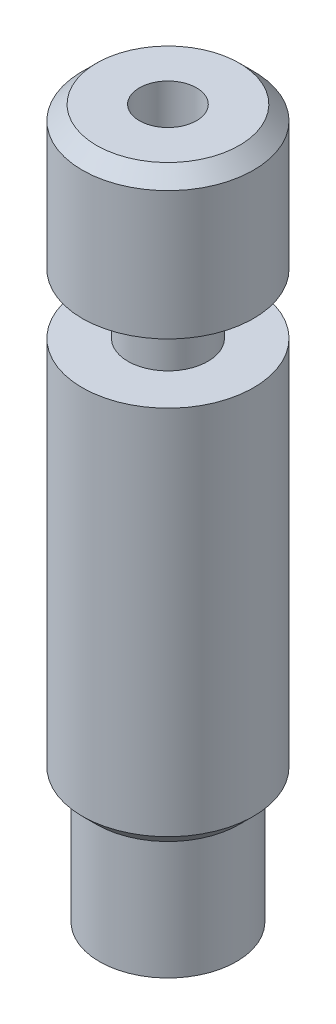
from build123d import *


with BuildPart() as part:
    # Sketch1 → Revolve1 (revolve)
    with BuildSketch(Plane.XY, mode=Mode.PRIVATE) as revolve1_sk:
        Polygon((1, -12.15), (1, 12.55), (2.5, 12.55), (3, 12.05), (3, 7.55), (1.4, 7.55), (1.4, 5.45), (3, 5.45), (3, -7.55), (2.5, -8.05), (2.4, -8.05), (2.4, -12.261324865), (1.9, -12.55), (1.4, -12.55), align=None)
    revolve(revolve1_sk.sketch.rotate(Axis((0, 12.55, 0), (0, -1, 0)), 90), axis=Axis((0, 12.55, 0), (0, -1, 0)))


solid = part.part
